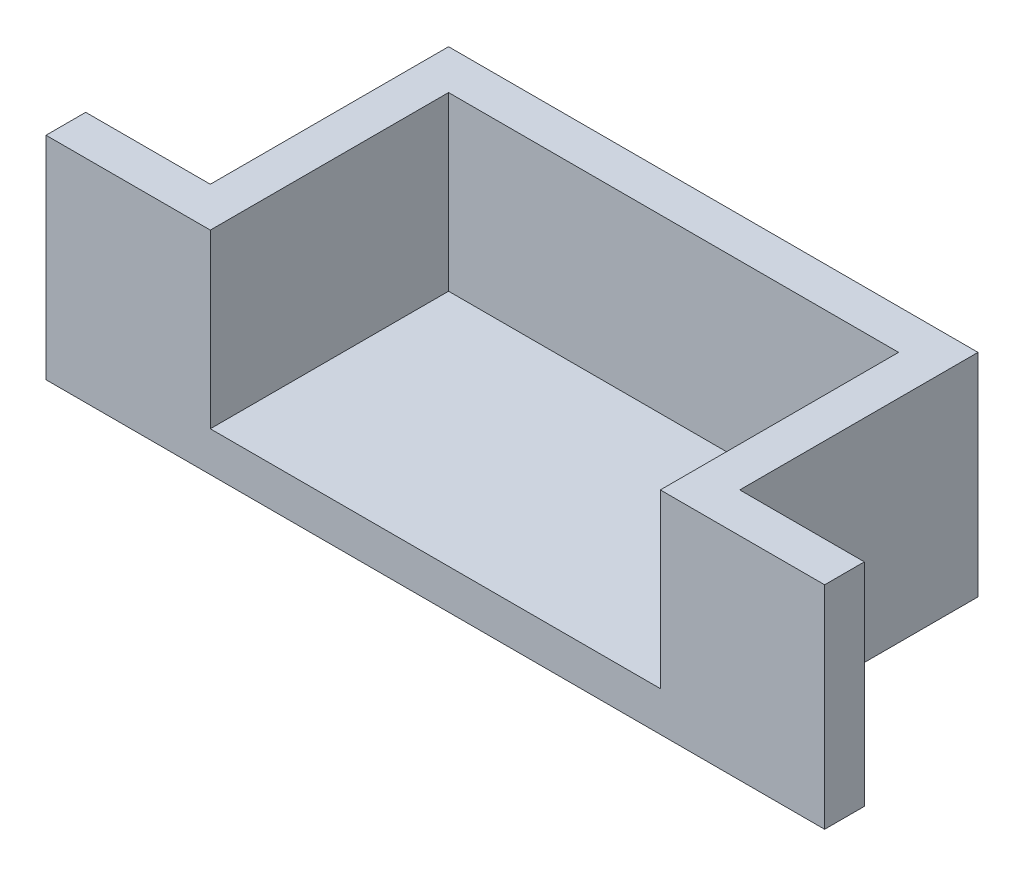
from build123d import *

# Parameters (mm, degrees)
SKETCH1_W           = 3
SKETCH1_H           = 15
SKETCH1_W_2         = 12.413793103
SKETCH1_H_2         = 3
BOSS_EXTRUDE1_DEPTH = 16
SKETCH2_W           = 34
SKETCH2_H           = 18
BOSS_EXTRUDE2_DEPTH = 3


with BuildPart() as part:
    # Sketch1 → Boss-Extrude1 (new body)
    with BuildSketch(Plane(origin=(0, 0, 0), x_dir=(1, 0, 0), z_dir=(0, 1, 0))):
        with Locations((-18.5, -2.557471264)):
            Rectangle(SKETCH1_W, SKETCH1_H)
        with Locations((-23.206896552, -11.557471264)):
            Rectangle(SKETCH1_W_2, SKETCH1_H_2)
        Polygon((0, 7.942528736), (-20, 7.942528736), (-20, 4.942528736), (-17, 4.942528736), (0, 4.942528736), align=None)
        Polygon((20, 7.942528736), (0, 7.942528736), (0, 4.942528736), (17, 4.942528736), (20, 4.942528736), align=None)
        with Locations((18.5, -2.557471264)):
            Rectangle(SKETCH1_W, SKETCH1_H)
        Polygon((29.413793103, -10.057471264), (20, -10.057471264), (17, -10.057471264), (17, -13.057471264), (29.413793103, -13.057471264), align=None)
    extrude(amount=BOSS_EXTRUDE1_DEPTH)

    # Sketch2 → Boss-Extrude2 (add)
    with BuildSketch(Plane(origin=(0, 0, 0), x_dir=(1, 0, 0), z_dir=(0, 1, 0))):
        with Locations((0, -4.057471264)):
            Rectangle(SKETCH2_W, SKETCH2_H)
    extrude(amount=BOSS_EXTRUDE2_DEPTH)


solid = part.part
